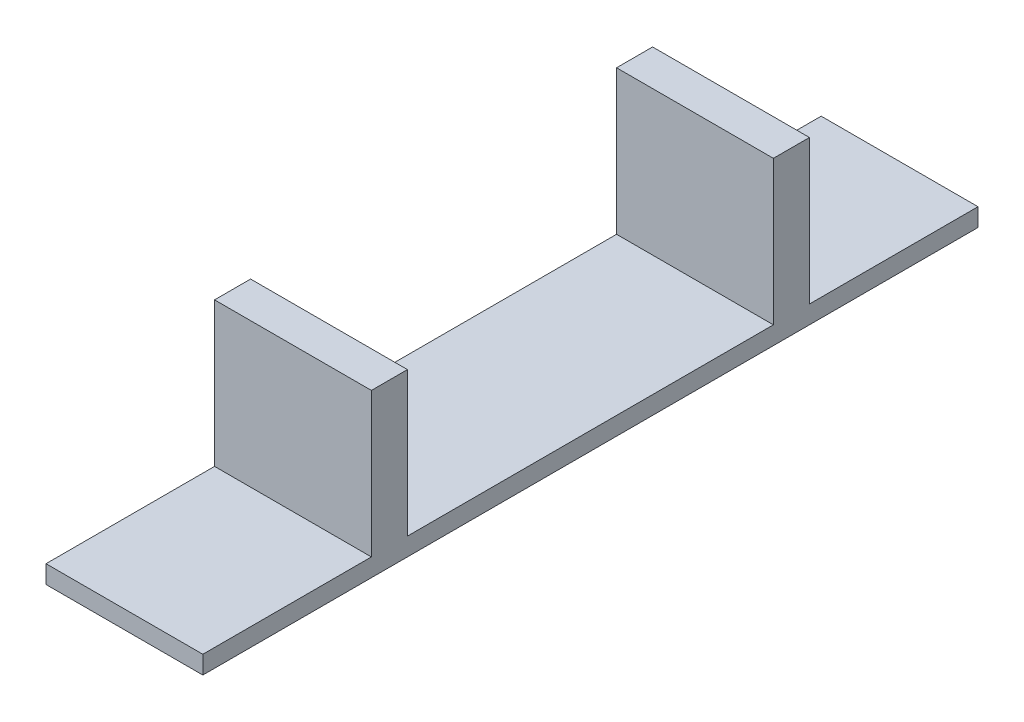
from build123d import *

# Parameters (mm, degrees)
CROQUIS1_W              = 8.7
CROQUIS1_H              = 43
SALIENTE_EXTRUIR1_DEPTH = 1
CROQUIS2_W              = 8.7
CROQUIS2_H              = 2
SALIENTE_EXTRUIR2_DEPTH = 8


with BuildPart() as part:
    # Croquis1 → Saliente-Extruir1 (new body)
    with BuildSketch(Plane(origin=(0, 0, 0), x_dir=(1, 0, 0), z_dir=(0, 1, 0))):
        with Locations((-4.35, -21.5)):
            Rectangle(CROQUIS1_W, CROQUIS1_H)
    extrude(amount=SALIENTE_EXTRUIR1_DEPTH)

    # Croquis2 → Saliente-Extruir2 (add)
    with BuildSketch(Plane(origin=(0, 1, 0), x_dir=(1, 0, 0), z_dir=(0, 1, 0))):
        with Locations((-4.35, -10.35)):
            Rectangle(CROQUIS2_W, CROQUIS2_H)
        with Locations((-4.35, -32.65)):
            Rectangle(CROQUIS2_W, CROQUIS2_H)
    extrude(amount=SALIENTE_EXTRUIR2_DEPTH)


solid = part.part
